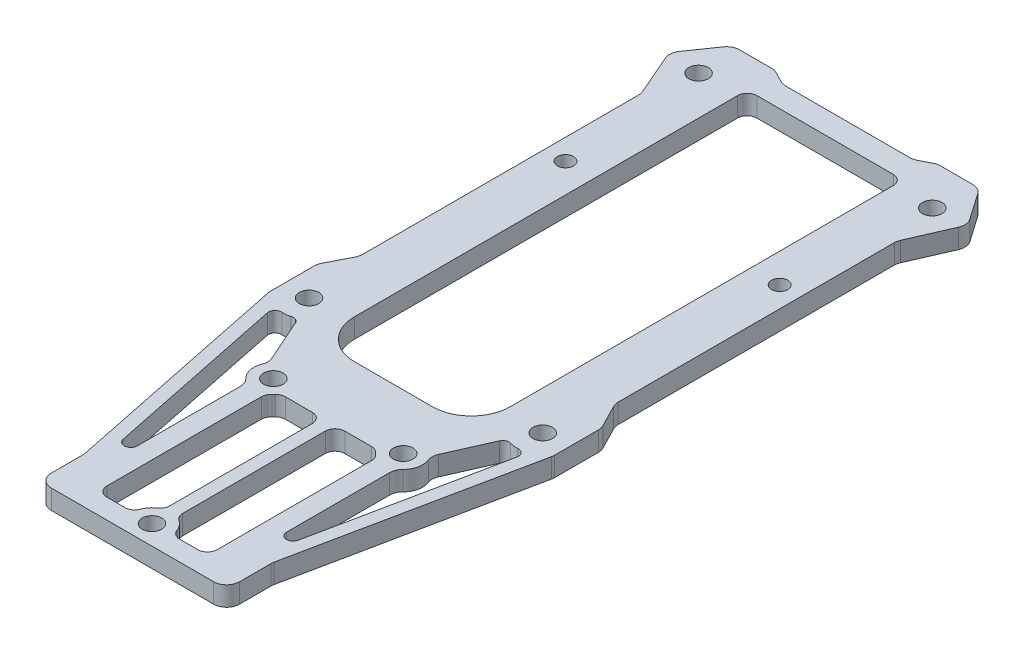
from build123d import *

# Parameters (mm, degrees)
SKETCH_1_R          = 1.5
SKETCH_1_R_2        = 1.25
SKETCH_1_W          = 24
SKETCH_1_H          = 66.5
EXTRUDE_1_DEPTH     = 3
FILLET_1_R          = 1.5
CUT_EXTRUDE_1_DEPTH = 3
FILLET_2_R          = 1
FILLET_3_R          = 1.5
FILLET_4_R          = 2
FILLET_5_R          = 2
FILLET_6_R          = 6


with BuildPart() as part:
    # 草图1 → 凸台-拉伸1 (new body)
    with BuildSketch(Plane(origin=(0, 0, 0), x_dir=(1, 0, 0), z_dir=(0, 1, 0))):
        Polygon((10.04233564, 35), (-10.04233564, 35), (-12.523742682, 36.273217412), (-19.001684764, 36.273217412), (-23.015493308, 30.5), (-19.695655938, 22.877483708), (-19.695655938, -20.552984489), (-21.884751354, -24.819370363), (-21.884751354, -32.255531362), (-14.5, -68.123136609), (-14.5, -75.2), (14.5, -75.2), (14.5, -68.123136609), (21.884751354, -32.255531362), (21.884751354, -24.819370363), (19.695655938, -20.552984489), (19.695655938, 22.877483708), (23.015493308, 30.5), (19.001684764, 36.273217412), (12.523742682, 36.273217412), align=None)
        with Locations(Location((-18, 30, 0), (0, 0, 270))):
            Circle(SKETCH_1_R, mode=Mode.SUBTRACT)
        with Locations(Location((18, 30, 0), (0, 0, 270))):
            Circle(SKETCH_1_R, mode=Mode.SUBTRACT)
        with Locations(Location((18, -30, 0), (0, 0, 270))):
            Circle(SKETCH_1_R, mode=Mode.SUBTRACT)
        with Locations(Location((-18, -30, 0), (0, 0, 270))):
            Circle(SKETCH_1_R, mode=Mode.SUBTRACT)
        with Locations(Location((0, -72.2, 0), (0, 0, 270))):
            Circle(SKETCH_1_R, mode=Mode.SUBTRACT)
        with Locations(Location((-10, -43.5, 0), (0, 0, 270))):
            Circle(SKETCH_1_R, mode=Mode.SUBTRACT)
        with Locations(Location((10, -43.5, 0), (0, 0, 90))):
            Circle(SKETCH_1_R, mode=Mode.SUBTRACT)
        with Locations(Location((-16.5, 8, 0), (0, 0, 270))):
            Circle(SKETCH_1_R_2, mode=Mode.SUBTRACT)
        with Locations(Location((16.5, 8, 0), (0, 0, 90))):
            Circle(SKETCH_1_R_2, mode=Mode.SUBTRACT)
        with Locations((0, -1.75)):
            Rectangle(SKETCH_1_W, SKETCH_1_H, mode=Mode.SUBTRACT)
    extrude(amount=EXTRUDE_1_DEPTH)

    # 圆角1
    fillet_1_edges = [part.edges().sort_by_distance(p)[0] for p in [
        (12, 1.5, -31.5),
        (-12, 1.5, -31.5),
    ]]
    fillet(fillet_1_edges, radius=FILLET_1_R)

    # 草图2 → 切除-拉伸1 (cut)
    with BuildSketch(Plane(origin=(0, 3, 0), x_dir=(1, 0, 0), z_dir=(0, 1, 0))):
        with BuildLine():
            ThreePointArc((-16.09935509, -33.519594994), (-17.804419777, -33.995215686), (-19.547787148, -33.688408186))
            Line((-19.547787148, -33.688408186), (-11.5, -72.77636643))
            Line((-11.5, -72.77636643), (-11.5, -46.098076211))
            ThreePointArc((-11.5, -46.098076211), (-12.930484116, -44.14207698), (-12.448919233, -41.767142652))
            Line((-12.448919233, -41.767142652), (-16.09935509, -33.519594994))
        make_face()
        with BuildLine():
            ThreePointArc((-7.401923789, -45), (-7.878679656, -45.621320344), (-8.5, -46.098076211))
            Line((-8.5, -46.098076211), (-8.5, -72.142731986))
            Line((-8.5, -72.142731986), (-2.999453346, -72.142731986))
            ThreePointArc((-2.999453346, -72.142731986), (-2.43284555, -70.444647463), (-1, -69.371572875))
            Line((-1, -69.371572875), (-1, -45))
            Line((-1, -45), (-7.401923789, -45))
        make_face()
        with BuildLine():
            Line((7.401923789, -45), (1, -45))
            Line((1, -45), (1, -69.371572875))
            ThreePointArc((1, -69.371572875), (2.43284555, -70.444647463), (2.999453346, -72.142731986))
            Line((2.999453346, -72.142731986), (8.5, -72.142731986))
            Line((8.5, -72.142731986), (8.5, -46.098076211))
            ThreePointArc((8.5, -46.098076211), (7.878679656, -45.621320344), (7.401923789, -45))
        make_face()
        with BuildLine():
            ThreePointArc((12.448919233, -41.767142652), (12.930484116, -44.14207698), (11.5, -46.098076211))
            Line((11.5, -46.098076211), (11.5, -72.77636643))
            Line((11.5, -72.77636643), (19.547787148, -33.688408186))
            ThreePointArc((19.547787148, -33.688408186), (17.804419777, -33.995215686), (16.09935509, -33.519594994))
            Line((16.09935509, -33.519594994), (12.448919233, -41.767142652))
        make_face()
    extrude(amount=-CUT_EXTRUDE_1_DEPTH, mode=Mode.SUBTRACT)

    # 圆角2
    fillet_2_edges = [part.edges().sort_by_distance(p)[0] for p in [
        (-11.5, 1.5, 72.77636643),
        (-19.547787148, 1.5, 33.688408186),
        (-16.09935509, 1.5, 33.519594994),
        (19.547787148, 1.5, 33.688408186),
        (11.5, 1.5, 72.77636643),
        (16.09935509, 1.5, 33.519594994),
    ]]
    fillet(fillet_2_edges, radius=FILLET_2_R)

    # 圆角3
    fillet_3_edges = [part.edges().sort_by_distance(p)[0] for p in [
        (8.5, 1.5, 46.098076211),
        (8.5, 1.5, 72.142731986),
        (2.999453346, 1.5, 72.142731986),
        (1, 1.5, 69.371572875),
        (1, 1.5, 45),
        (7.401923789, 1.5, 45),
        (-1, 1.5, 69.371572875),
        (-2.999453346, 1.5, 72.142731986),
        (-8.5, 1.5, 72.142731986),
        (-8.5, 1.5, 46.098076211),
        (-7.401923789, 1.5, 45),
        (-1, 1.5, 45),
    ]]
    fillet(fillet_3_edges, radius=FILLET_3_R)

    # 圆角4
    fillet_4_edges = [part.edges().sort_by_distance(p)[0] for p in [
        (-12.448919233, 1.5, 41.767142652),
        (-11.5, 1.5, 46.098076211),
        (11.5, 1.5, 46.098076211),
        (12.448919233, 1.5, 41.767142652),
    ]]
    fillet(fillet_4_edges, radius=FILLET_4_R)

    # 圆角5
    fillet_5_edges = [part.edges().sort_by_distance(p)[0] for p in [
        (-12.523742682, 1.5, -36.273217412),
        (-10.04233564, 1.5, -35),
        (10.04233564, 1.5, -35),
        (12.523742682, 1.5, -36.273217412),
        (19.001684764, 1.5, -36.273217412),
        (23.015493308, 1.5, -30.5),
        (19.695655938, 1.5, -22.877483708),
        (19.695655938, 1.5, 20.552984489),
        (21.884751354, 1.5, 24.819370363),
        (21.884751354, 1.5, 32.255531362),
        (14.5, 1.5, 68.123136609),
        (14.5, 1.5, 75.2),
        (-14.5, 1.5, 75.2),
        (-14.5, 1.5, 68.123136609),
        (-21.884751354, 1.5, 32.255531362),
        (-21.884751354, 1.5, 24.819370363),
        (-19.695655938, 1.5, 20.552984489),
        (-19.695655938, 1.5, -22.877483708),
        (-23.015493308, 1.5, -30.5),
        (-19.001684764, 1.5, -36.273217412),
    ]]
    fillet(fillet_5_edges, radius=FILLET_5_R)

    # 圆角6
    fillet_6_edges = [part.edges().sort_by_distance(p)[0] for p in [
        (12, 1.5, 35),
        (-12, 1.5, 35),
    ]]
    fillet(fillet_6_edges, radius=FILLET_6_R)


solid = part.part
